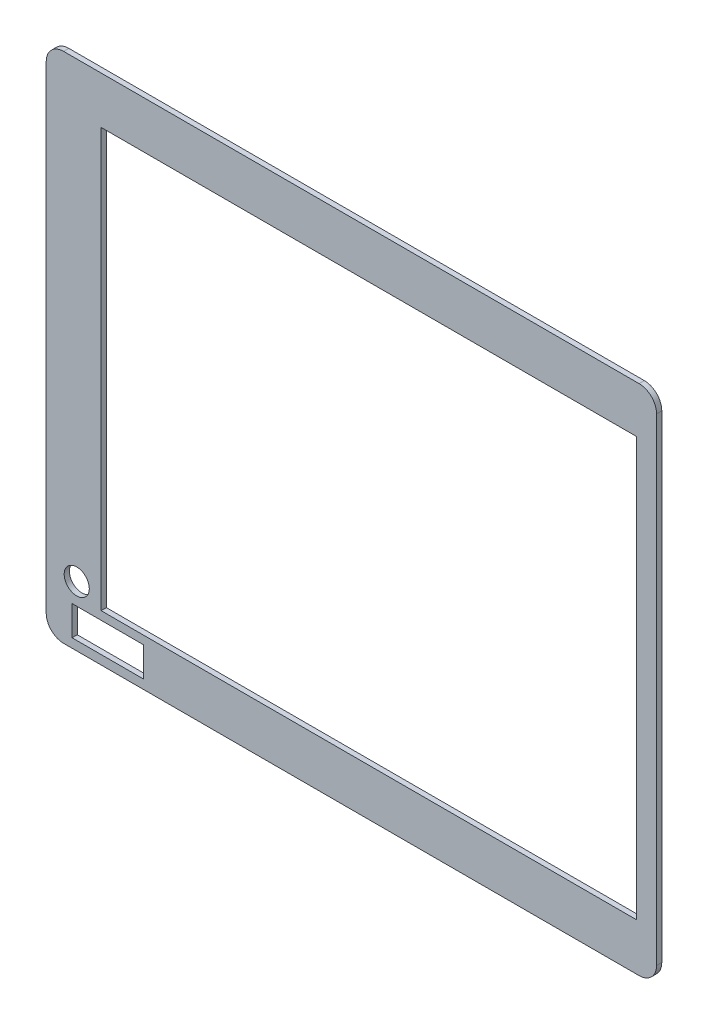
from build123d import *

# Parameters (mm, degrees)
SKETCH1_W           = 700
SKETCH1_H           = 588
BOSS_EXTRUDE1_DEPTH = 6
FILLET1_R           = 20
SKETCH2_R           = 14.4
SKETCH2_W           = 614
SKETCH2_H           = 480
SKETCH2_W_2         = 82
SKETCH2_H_2         = 34
CUT_EXTRUDE1_DEPTH  = 84


with BuildPart() as part:
    # Sketch1 → Boss-Extrude1 (new body)
    with BuildSketch(Plane.XY):
        Rectangle(SKETCH1_W, SKETCH1_H)
    extrude(amount=BOSS_EXTRUDE1_DEPTH)

    # Fillet1
    fillet1_edges = [part.edges().sort_by_distance(p)[0] for p in [
        (350, -294, 3),
        (-350, -294, 3),
        (-350, 294, 3),
        (350, 294, 3),
    ]]
    fillet(fillet1_edges, radius=FILLET1_R)

    # Sketch2 → Cut-Extrude1 (cut)
    with BuildSketch(Plane.XY.offset(6)):
        with Locations((-315, -225)):
            Circle(SKETCH2_R)
        with Locations((20, 0)):
            Rectangle(SKETCH2_W, SKETCH2_H)
        with Locations((-279.35, -266.6)):
            Rectangle(SKETCH2_W_2, SKETCH2_H_2)
    extrude(amount=-CUT_EXTRUDE1_DEPTH, mode=Mode.SUBTRACT)


solid = part.part
